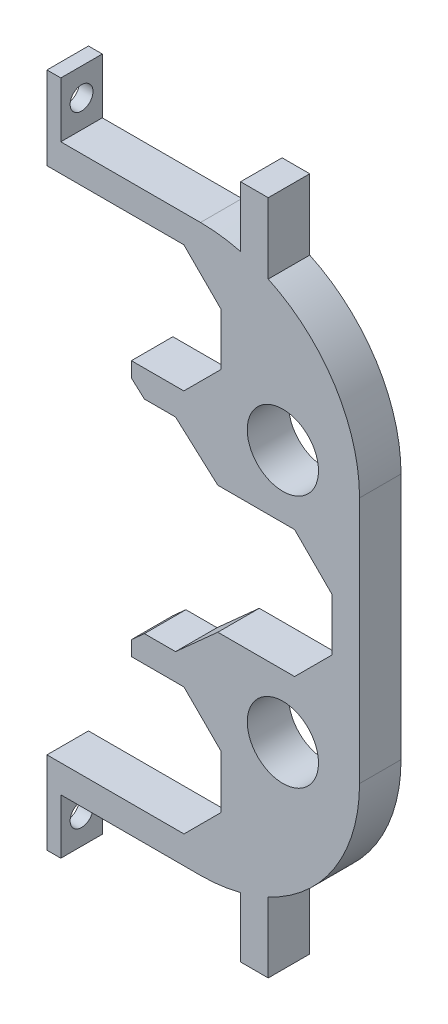
from build123d import *

# Parameters (mm, degrees)
EXTRUDE_1_DEPTH     = 6
SKETCH_2_W          = 6
SKETCH_2_H          = 8
SKETCH_2_R          = 1.65
EXTRUDE_2_DEPTH     = 2
EXTRUDE_START       = -32
SKETCH_3_W          = 6
SKETCH_3_H          = 12
EXTRUDE_3_DEPTH     = 4
CUT_EXTRUDE_1_REACH = 68.837
SKETCH_4_R          = 5.15


with BuildPart() as part:
    # 草图1 → 凸台-拉伸1 (new body)
    with BuildSketch(Plane.XY.offset(228)):
        with BuildLine():
            Line((25.153300859, 23.921391565), (19.791421356, 18.559512062))
            Line((19.791421356, 18.559512062), (12.208578644, 18.559512062))
            Line((12.208578644, 18.559512062), (12.208578644, 16.380432911))
            Line((12.208578644, 16.380432911), (14.08992832, 14.6918887))
            Line((14.08992832, 14.6918887), (18.591338638, 14.6918887))
            Line((18.591338638, 14.6918887), (24.706637775, 9.203300859))
            Line((24.706637775, 9.203300859), (28.187867966, 9.203300859))
            Line((28.187867966, 9.203300859), (35.812132034, 9.203300859))
            Line((35.812132034, 9.203300859), (41.203300859, 3.812132034))
            Line((41.203300859, 3.812132034), (41.203300859, -3.812132034))
            Line((41.203300859, -3.812132034), (35.812132034, -9.203300859))
            Line((35.812132034, -9.203300859), (28.187867966, -9.203300859))
            Line((28.187867966, -9.203300859), (24.706637775, -9.203300859))
            Line((24.706637775, -9.203300859), (18.591338638, -14.6918887))
            Line((18.591338638, -14.6918887), (14.08992832, -14.6918887))
            Line((14.08992832, -14.6918887), (12.208578644, -16.380432911))
            Line((12.208578644, -16.380432911), (12.187867966, -18.509512062))
            Line((12.187867966, -18.509512062), (19.812132034, -18.509512062))
            Line((19.812132034, -18.509512062), (25.203300859, -23.900680887))
            Line((25.203300859, -23.900680887), (25.203300859, -31.524944955))
            Line((25.203300859, -31.524944955), (19.812132034, -36.91611378))
            Line((19.812132034, -36.91611378), (12.187867966, -36.91611378))
            Line((12.187867966, -36.91611378), (0, -36.91611378))
            Line((0, -36.91611378), (0, -40.91611378))
            Line((0, -40.91611378), (22.203300859, -40.91611378))
            ThreePointArc((22.203300859, -40.91611378), (38.466756826, -34.179569747), (45.203300859, -17.91611378))
            Line((45.203300859, -17.91611378), (45.203300859, 17.86611378))
            ThreePointArc((45.203300859, 17.86611378), (38.466756826, 34.129569747), (22.203300859, 40.86611378))
            Line((22.203300859, 40.86611378), (0, 40.86611378))
            Line((0, 40.86611378), (0, 36.86611378))
            Line((0, 36.86611378), (12.208578644, 36.86611378))
            Line((12.208578644, 36.86611378), (19.791421356, 36.86611378))
            Line((19.791421356, 36.86611378), (25.153300859, 31.504234277))
            Line((25.153300859, 31.504234277), (25.153300859, 23.921391565))
        make_face()
    extrude(amount=-EXTRUDE_1_DEPTH)

    # 草图2 → 凸台-拉伸2 (add)
    # profile 1 of 2: a face of its own
    with BuildSketch(Plane.ZY):
        with Locations((225, 44.86611378)):
            Rectangle(SKETCH_2_W, SKETCH_2_H)
        with Locations(Location((225, 44.86611378, 0), (0, 0, 270))):
            Circle(SKETCH_2_R, mode=Mode.SUBTRACT)
    # profile 2 of 2: a face of its own
    with BuildSketch(Plane.ZY):
        with Locations((225, -44.86611378)):
            Rectangle(SKETCH_2_W, SKETCH_2_H)
        with Locations(Location((225, -44.86611378, 0), (0, 0, 90))):
            Circle(SKETCH_2_R, mode=Mode.SUBTRACT)
    extrude(amount=-EXTRUDE_2_DEPTH)

    # 草图3 → 凸台-拉伸3 (add)
    with BuildSketch(Plane.ZY.offset(EXTRUDE_START)):
        with Locations((225, 42.86611378)):
            Rectangle(SKETCH_3_W, SKETCH_3_H)
        with Locations((225, -42.86611378)):
            Rectangle(SKETCH_3_W, SKETCH_3_H)
    extrude(amount=EXTRUDE_3_DEPTH)

    # 草图4 → 切除-拉伸1 (cut, up to next)
    with BuildSketch(Plane(origin=(0, 0, 222), x_dir=(-1, 0, 0), z_dir=(0, 0, -1)), mode=Mode.PRIVATE) as cut_extrude_1_sk1:
        with Locations((-34.116390274, 18.292236363)):
            Circle(SKETCH_4_R)
    cut_extrude_1_tool1 = extrude(cut_extrude_1_sk1.sketch, amount=-CUT_EXTRUDE_1_REACH, mode=Mode.PRIVATE) & part.part
    # 草图4 → 切除-拉伸1 (cut, up to next)
    with BuildSketch(Plane(origin=(0, 0, 222), x_dir=(-1, 0, 0), z_dir=(0, 0, -1)), mode=Mode.PRIVATE) as cut_extrude_1_sk2:
        with Locations(Location((-34.116390274, -18.292236363, 0), (0, 0, 180))):
            Circle(SKETCH_4_R)
    cut_extrude_1_tool2 = extrude(cut_extrude_1_sk2.sketch, amount=-CUT_EXTRUDE_1_REACH, mode=Mode.PRIVATE) & part.part
    add(cut_extrude_1_tool1.solids().sort_by_distance((34.11639, 18.292236, 222))[0], mode=Mode.SUBTRACT)
    add(cut_extrude_1_tool2.solids().sort_by_distance((34.11639, -18.292236, 222))[0], mode=Mode.SUBTRACT)


solid = part.part
